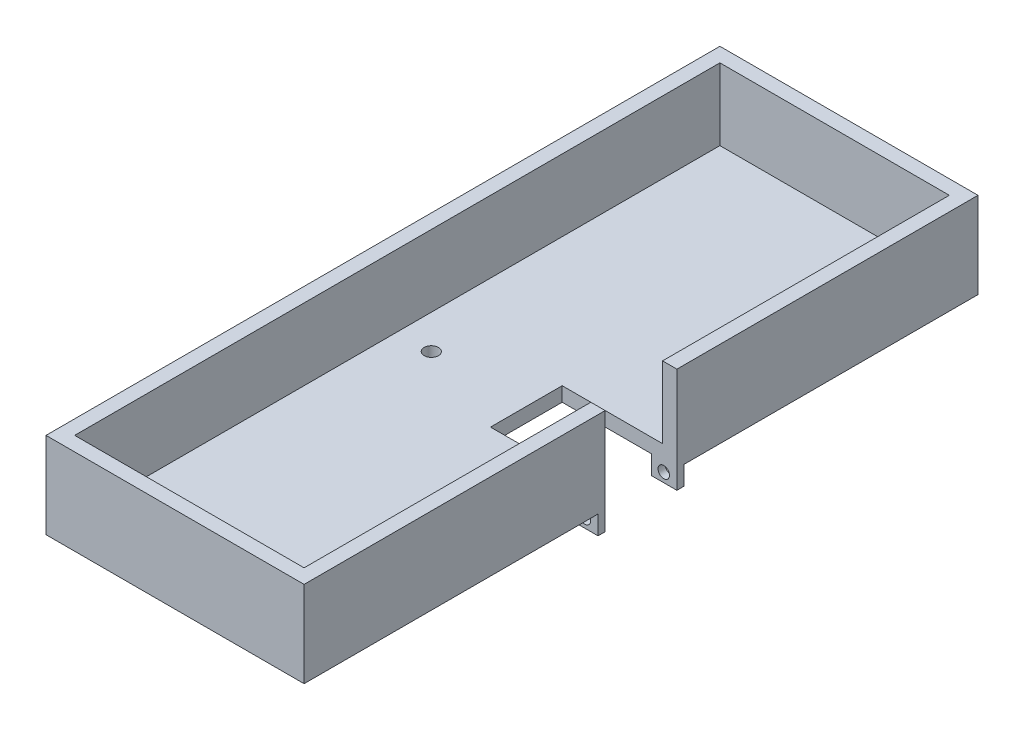
from build123d import *

# Parameters (mm, degrees)
BOSS_EXTRUDE1_DEPTH = 470
SKETCH2_R           = 5
CUT_EXTRUDE1_DEPTH  = 506.766744656
BOSS_EXTRUDE2_DEPTH = 50
SKETCH4_W           = 70
SKETCH4_H           = 25
SKETCH4_W_2         = 10
CUT_EXTRUDE2_DEPTH  = 80
SKETCH6_W           = 17.656216206
SKETCH6_H           = 13.202094069
SKETCH6_R           = 4
BOSS_EXTRUDE3_DEPTH = 5


with BuildPart() as part:
    # Sketch1 → Boss-Extrude1 (new body)
    with BuildSketch(Plane.XY):
        Polygon((180, -50), (180, -60), (0, -60), (0, 0), (10, 0), (10, -50), align=None)
    extrude(amount=BOSS_EXTRUDE1_DEPTH)

    # Sketch2 → Cut-Extrude1 (cut, through all)
    with BuildSketch(Plane(origin=(0, -50, 0), x_dir=(1, 0, 0), z_dir=(0, 1, 0))):
        with Locations(Location((33.75, -235, 0), (0, 0, 270))):
            Circle(SKETCH2_R)
    extrude(amount=-CUT_EXTRUDE1_DEPTH, mode=Mode.SUBTRACT)

    # Sketch3 → Boss-Extrude2 (add)
    with BuildSketch(Plane(origin=(0, -50, 0), x_dir=(1, 0, 0), z_dir=(0, 1, 0))):
        Polygon((10, -460), (10, -470), (180, -470), (180, 0), (10, 0), (10, -10), (170, -10), (170, -460), align=None)
    extrude(amount=BOSS_EXTRUDE2_DEPTH)

    # Sketch4 → Cut-Extrude2 (cut, symmetric)
    with BuildSketch(Plane(origin=(0, -50, 0), x_dir=(1, 0, 0), z_dir=(0, 1, 0))):
        with Locations((135, -222.5)):
            Rectangle(SKETCH4_W, SKETCH4_H)
        with Locations((135, -247.5)):
            Rectangle(SKETCH4_W, SKETCH4_H)
        with Locations((175, -222.5)):
            Rectangle(SKETCH4_W_2, SKETCH4_H)
        with Locations((175, -247.5)):
            Rectangle(SKETCH4_W_2, SKETCH4_H)
    extrude(amount=CUT_EXTRUDE2_DEPTH, both=True, mode=Mode.SUBTRACT)

    # Sketch6 → Boss-Extrude3 (add)
    with BuildSketch(Plane.XY.offset(210)):
        with Locations((171.171891897, -66.601047034)):
            Rectangle(SKETCH6_W, SKETCH6_H)
        with Locations((170.838161539, -66.744917763)):
            Circle(SKETCH6_R, mode=Mode.SUBTRACT)
    boss_extrude3 = extrude(amount=-BOSS_EXTRUDE3_DEPTH)

    # Mirror1: Boss-Extrude3 across plane
    add(boss_extrude3.mirror(Plane.XY.offset(235)))


solid = part.part
